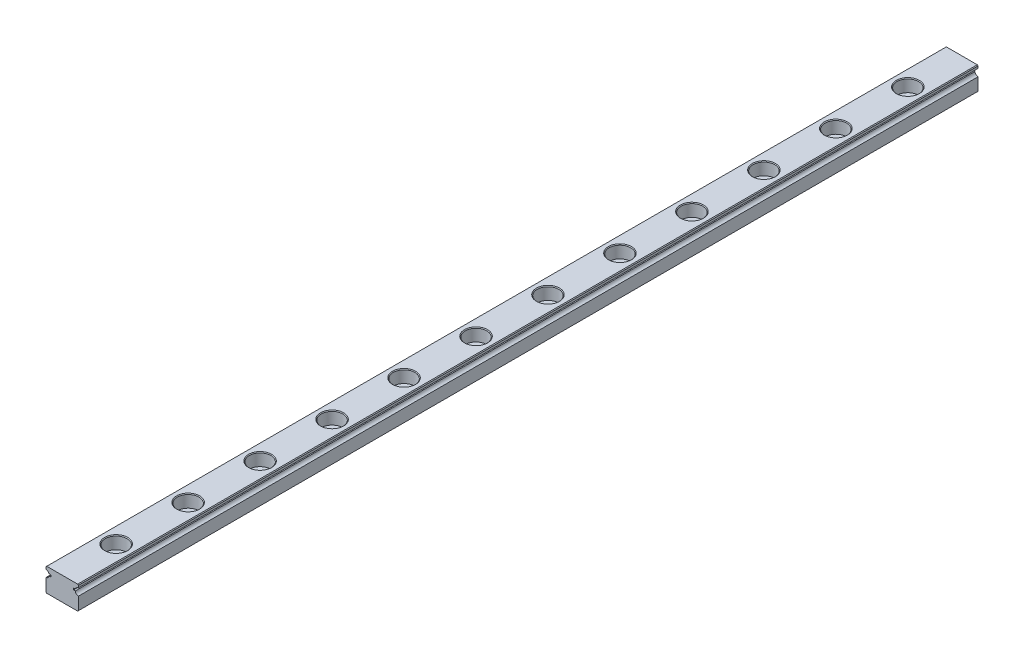
from build123d import *

# Parameters (mm, degrees)
EXTRUDE_RAIL_PROFILE_DEPTH = 250
EXTRUDE2_REACH             = 252.125
SKETCH2_R                  = 1.75
SKETCH_R                   = 3
SKETCH_R_2                 = 1.75
EXTRUDE4_DEPTH             = 3.5
CHAMFER1_SIZE              = 0.2
LPATTERN1_COUNT            = 12
LPATTERN1_PITCH            = 20
CHAMFER1_OF_LPATTERN1_SIZE = 0.2


with BuildPart() as part:
    # Sketch1 → Extrude Rail Profile (new body)
    with BuildSketch(Plane.XY):
        with BuildLine():
            Line((-4.3, -3.25), (4.3, -3.25))
            Line((4.3, -3.25), (4.5, -3.05))
            Line((4.5, -3.05), (4.5, 0.455012563))
            ThreePointArc((4.5, 0.455012563), (3.924845827, 0.712323349), (3.617735397, 1.2625))
            Line((3.617735397, 1.2625), (3.15008224, 1.2625))
            Line((3.15008224, 1.2625), (3.15008224, 1.7625))
            Line((3.15008224, 1.7625), (3.65008224, 1.7625))
            ThreePointArc((3.65008224, 1.7625), (3.973877727, 2.229724887), (4.5, 2.444987437))
            Line((4.5, 2.444987437), (4.5, 3.05))
            Line((4.5, 3.05), (4.3, 3.25))
            Line((4.3, 3.25), (-4.3, 3.25))
            Line((-4.3, 3.25), (-4.5, 3.05))
            Line((-4.5, 3.05), (-4.5, 2.444987437))
            ThreePointArc((-4.5, 2.444987437), (-3.973877727, 2.229724887), (-3.65008224, 1.7625))
            Line((-3.65008224, 1.7625), (-3.15008224, 1.7625))
            Line((-3.15008224, 1.7625), (-3.15008224, 1.2625))
            Line((-3.15008224, 1.2625), (-3.617735397, 1.2625))
            ThreePointArc((-3.617735397, 1.2625), (-3.924845827, 0.712323349), (-4.5, 0.455012563))
            Line((-4.5, 0.455012563), (-4.5, -3.05))
            Line((-4.5, -3.05), (-4.3, -3.25))
        make_face()
    extrude(amount=EXTRUDE_RAIL_PROFILE_DEPTH)

    # Sketch2 → Extrude2 (cut, up to next)
    with BuildSketch(Plane(origin=(0, 3.25, 0), x_dir=(1, 0, 0), z_dir=(0, 1, 0)), mode=Mode.PRIVATE) as extrude2_sk1:
        with Locations((0, -15)):
            Circle(SKETCH2_R)
    extrude2_tool1 = extrude(extrude2_sk1.sketch, amount=-EXTRUDE2_REACH, mode=Mode.PRIVATE) & part.part
    extrude2 = extrude2_tool1.solids().sort_by_distance((0, 3.25, 15))[0]
    add(extrude2, mode=Mode.SUBTRACT)

    # Sketch → Extrude4 (cut)
    with BuildSketch(Plane(origin=(0, 3.25, 0), x_dir=(1, 0, 0), z_dir=(0, 1, 0))):
        with Locations((0, -15)):
            Circle(SKETCH_R)
        with Locations((0, -15)):
            Circle(SKETCH_R_2, mode=Mode.SUBTRACT)
    extrude4 = extrude(amount=-EXTRUDE4_DEPTH, mode=Mode.SUBTRACT)

    # Chamfer1
    chamfer1_edges = [part.edges().sort_by_distance(p)[0] for p in [
        (-1.75, -3.25, 15),
        (-3, 3.25, 15),
    ]]
    chamfer(chamfer1_edges, length=CHAMFER1_SIZE)

    # LPattern1: Extrude2, Extrude4 ×12
    with Locations(*[(0, 0, i * LPATTERN1_PITCH) for i in range(1, LPATTERN1_COUNT)]):
        add(extrude2, mode=Mode.SUBTRACT)
        add(extrude4, mode=Mode.SUBTRACT)

    # Chamfer1 of LPattern1
    chamfer1_of_lpattern1_edges = [part.edges().sort_by_distance(p)[0] for p in [
        (-1.75, -3.25, 35),
        (-3, 3.25, 35),
        (-1.75, -3.25, 55),
        (-3, 3.25, 55),
        (-1.75, -3.25, 75),
        (-3, 3.25, 75),
        (-1.75, -3.25, 95),
        (-3, 3.25, 95),
        (-1.75, -3.25, 115),
        (-3, 3.25, 115),
        (-1.75, -3.25, 135),
        (-3, 3.25, 135),
        (-1.75, -3.25, 155),
        (-3, 3.25, 155),
        (-1.75, -3.25, 175),
        (-3, 3.25, 175),
        (-1.75, -3.25, 195),
        (-3, 3.25, 195),
        (-1.75, -3.25, 215),
        (-3, 3.25, 215),
        (-1.75, -3.25, 235),
        (-3, 3.25, 235),
    ]]
    chamfer(chamfer1_of_lpattern1_edges, length=CHAMFER1_OF_LPATTERN1_SIZE)


solid = part.part
